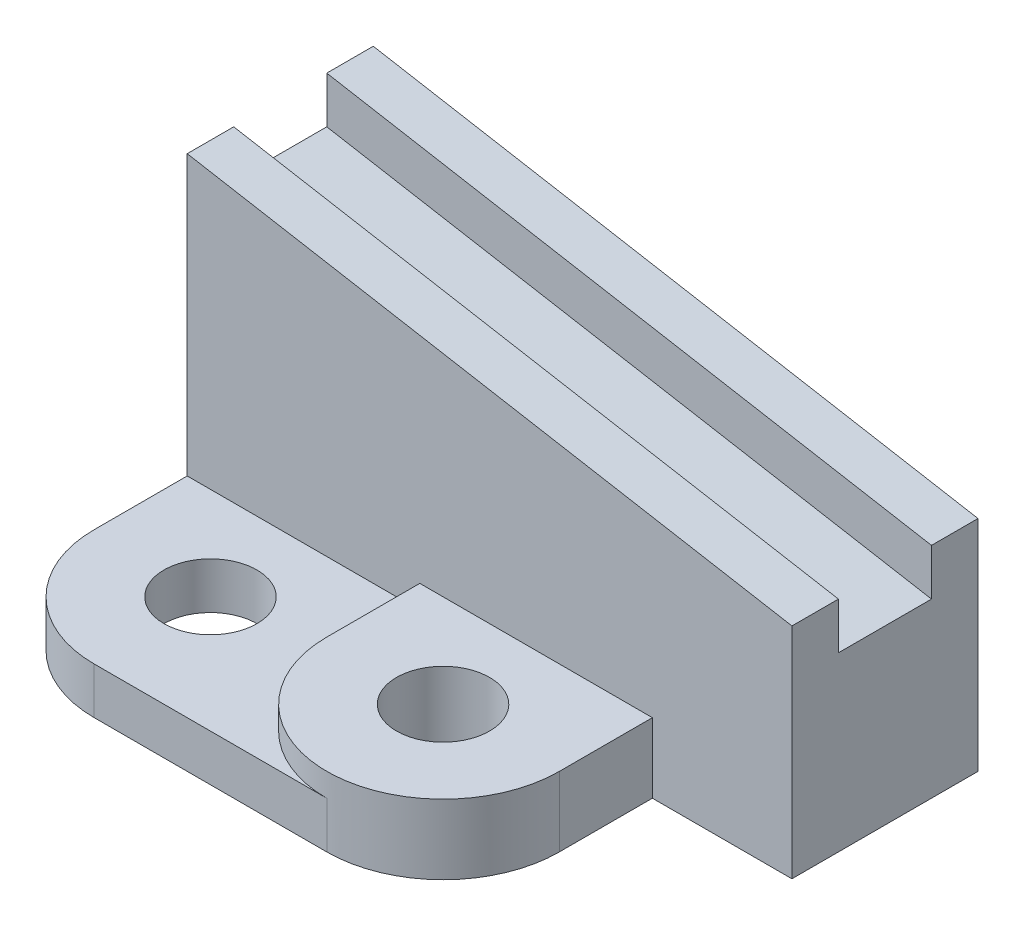
from build123d import *

# Parameters (mm, degrees)
SKETCH_1_W               = 130
SKETCH_1_H               = 10
EXTRUDE_1_DEPTH          = 70
EXTRUDE_1_2_DEPTH        = 70
SKETCH_1_3_W             = 130
SKETCH_1_3_H             = 20
EXTRUDE_2_DEPTH          = 60
SKETCH_3_W               = 20
SKETCH_3_H               = 22.922507492
CUT_EXTRUDE_4_DEPTH      = 130
CUT_EXTRUDE_5_DEPTH      = 153.970585408
CUT_EXTRUDE_5_DEPTH_BACK = 153.970585408
EXTRUDE_3_DEPTH          = 30
SKETCH_1_4_R             = 10
EXTRUDE_4_DEPTH          = 10
SKETCH_1_5_R             = 10
EXTRUDE_5_DEPTH          = 15


with BuildPart() as part:
    # 스케치1 → 보스-돌출1 (new body)
    with BuildSketch(Plane(origin=(0, 0, 0), x_dir=(1, 0, 0), z_dir=(0, 1, 0))):
        with Locations((65, -5)):
            Rectangle(SKETCH_1_W, SKETCH_1_H)
    extrude(amount=EXTRUDE_1_DEPTH)



with BuildPart() as body_2:
    # 스케치1 → Extrude 1 2 (new body)
    with BuildSketch(Plane(origin=(0, 0, 0), x_dir=(1, 0, 0), z_dir=(0, 1, 0))):
        with Locations((65, -35)):
            Rectangle(SKETCH_1_W, SKETCH_1_H)
    extrude(amount=EXTRUDE_1_2_DEPTH)


with BuildPart() as part_1:
    add(part.part)

    add(body_2.part)  # 보스-돌출2 merges body 2
    # 스케치1<3> → 보스-돌출2 (add)
    with BuildSketch(Plane(origin=(0, 0, 0), x_dir=(1, 0, 0), z_dir=(0, 1, 0))):
        with Locations((65, -20)):
            Rectangle(SKETCH_1_3_W, SKETCH_1_3_H)
    extrude(amount=EXTRUDE_2_DEPTH)

    # 스케치3 → 컷-돌출4 (cut)
    with BuildSketch(Plane(origin=(130, 0, 0), x_dir=(0, 0, -1), z_dir=(1, 0, 0))):
        with Locations((-20, 48.538746254)):
            Rectangle(SKETCH_3_W, SKETCH_3_H)
    extrude(amount=-CUT_EXTRUDE_4_DEPTH, mode=Mode.SUBTRACT)

    # 스케치2 → 컷-돌출5 (cut, two sides: drawn at the far end of the back side and taken through both)
    with BuildSketch(Plane.XY.offset(40).offset(-CUT_EXTRUDE_5_DEPTH_BACK)):
        Polygon((130, 70), (0, 70), (130, 47.077492508), align=None)
    extrude(amount=CUT_EXTRUDE_5_DEPTH + CUT_EXTRUDE_5_DEPTH_BACK, mode=Mode.SUBTRACT)

    # 스케치4 → 보스-돌출3 (add)
    with BuildSketch(Plane.XY.offset(40)):
        Polygon((130, 37.077492508), (0, 37.077492508), (0, 60), align=None)
    extrude(amount=-EXTRUDE_3_DEPTH)

    # 스케치1<4> → 보스-돌출4 (add)
    # profile 1 of 2: a face of its own
    with BuildSketch(Plane(origin=(0, 0, 0), x_dir=(1, 0, 0), z_dir=(0, 1, 0))):
        with BuildLine():
            Line((50, -40), (0, -40))
            Line((0, -40), (0, -60))
            ThreePointArc((0, -60), (7.32233047, -77.67766953), (25, -85))
            Line((25, -85), (75, -85))
            ThreePointArc((75, -85), (57.32233047, -77.67766953), (50, -60))
            Line((50, -60), (50, -40))
        make_face()
        with Locations(Location((25, -60, 0), (0, 0, 270))):
            Circle(SKETCH_1_4_R, mode=Mode.SUBTRACT)
    # profile 2 of 2: a face of its own
    with BuildSketch(Plane(origin=(0, 0, 0), x_dir=(1, 0, 0), z_dir=(0, 1, 0))):
        with BuildLine():
            Line((100, -40), (50, -40))
            Line((50, -40), (50, -60))
            ThreePointArc((50, -60), (57.32233047, -77.67766953), (75, -85))
            ThreePointArc((75, -85), (92.67766953, -77.67766953), (100, -60))
            Line((100, -60), (100, -40))
        make_face()
        with Locations(Location((75, -60, 0), (0, 0, 270))):
            Circle(SKETCH_1_4_R, mode=Mode.SUBTRACT)
    extrude(amount=EXTRUDE_4_DEPTH)

    # 스케치1<5> → 보스-돌출5 (add)
    with BuildSketch(Plane(origin=(0, 0, 0), x_dir=(1, 0, 0), z_dir=(0, 1, 0))):
        with BuildLine():
            Line((100, -40), (50, -40))
            Line((50, -40), (50, -60))
            ThreePointArc((50, -60), (57.32233047, -77.67766953), (75, -85))
            ThreePointArc((75, -85), (92.67766953, -77.67766953), (100, -60))
            Line((100, -60), (100, -40))
        make_face()
        with Locations(Location((75, -60, 0), (0, 0, 270))):
            Circle(SKETCH_1_5_R, mode=Mode.SUBTRACT)
    extrude(amount=EXTRUDE_5_DEPTH)


solid = part_1.part
